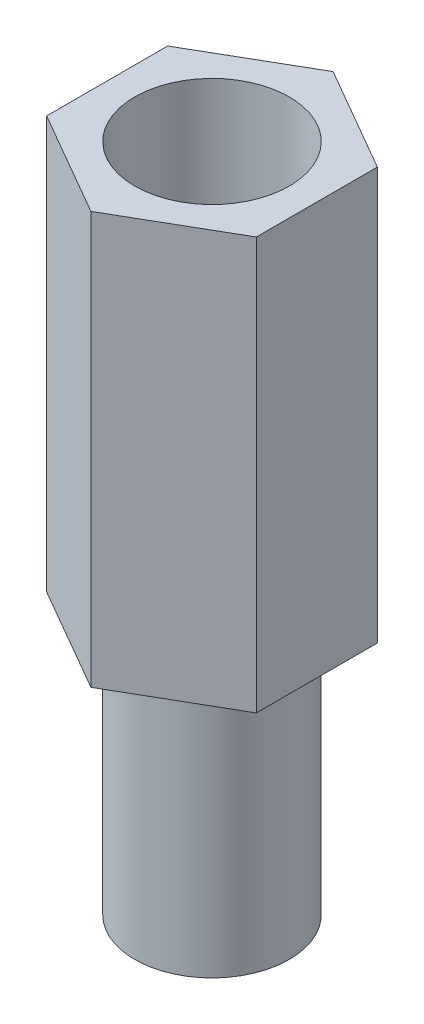
from build123d import *

# Parameters (mm, degrees)
EXTRUDE_1_DEPTH     = 8
SKETCH_2_R          = 1.5
CUT_EXTRUDE_1_DEPTH = 3
SKETCH_3_R          = 1.5
EXTRUDE_2_DEPTH     = 5


with BuildPart() as part:
    # 草图1 → 凸台-拉伸1 (new body)
    with BuildSketch(Plane(origin=(0, 0, 0), x_dir=(1, 0, 0), z_dir=(0, 1, 0))):
        Polygon((0, 2.35), (-2.035159699, 1.175), (-2.035159699, -1.175), (0, -2.35), (2.035159699, -1.175), (2.035159699, 1.175), align=None)
    extrude(amount=EXTRUDE_1_DEPTH)

    # 草图2 → 切除-拉伸1 (cut)
    with BuildSketch(Plane(origin=(0, 8, 0), x_dir=(1, 0, 0), z_dir=(0, 1, 0))):
        with Locations(Location((0, 0, 0), (0, 0, 270))):
            Circle(SKETCH_2_R)
    extrude(amount=-CUT_EXTRUDE_1_DEPTH, mode=Mode.SUBTRACT)

    # 草图3 → 凸台-拉伸2 (add)
    with BuildSketch(Plane.XZ):
        with Locations(Location((0, 0, 0), (0, 0, 90))):
            Circle(SKETCH_3_R)
    extrude(amount=EXTRUDE_2_DEPTH)


solid = part.part
